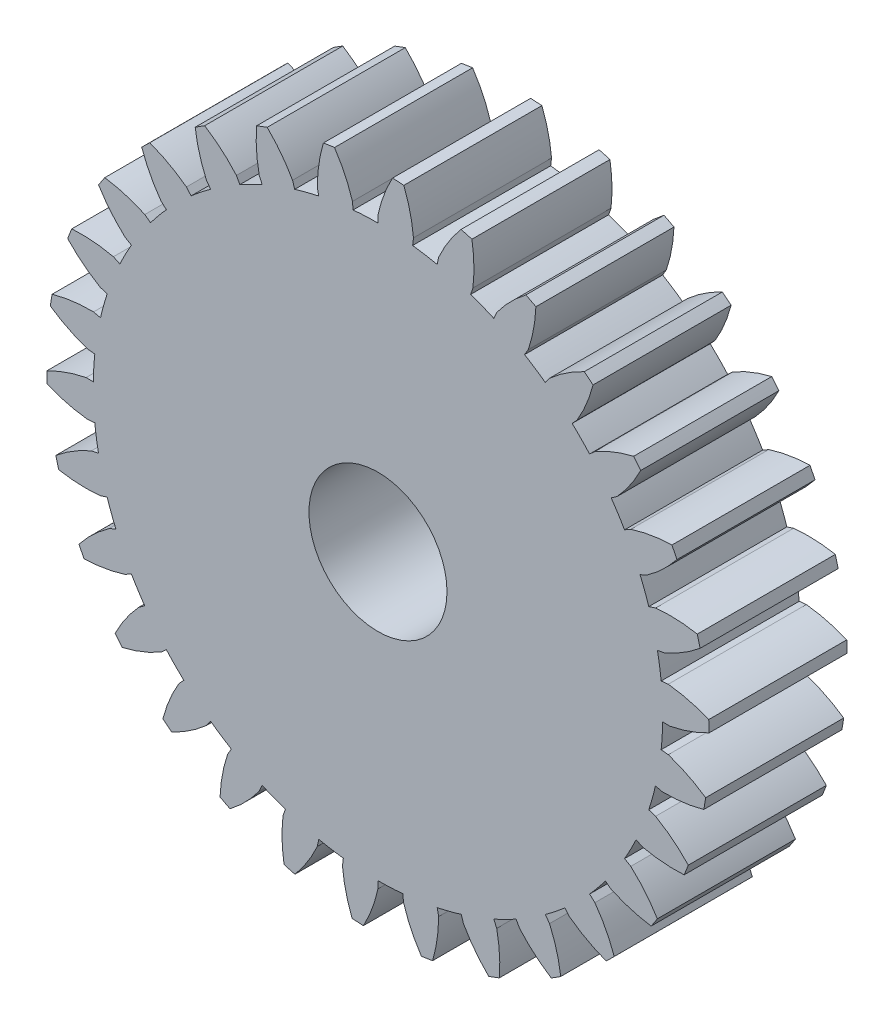
from build123d import *

# Parameters (mm, degrees)
BOSS_EXTRUDE1_DEPTH = 4
CIRPATTERN1_COUNT   = 30
SKETCH6_R           = 8.25
SKETCH6_R_2         = 2
BOSS_EXTRUDE3_DEPTH = 4


with BuildPart() as part:
    # Sketch3 → Boss-Extrude1 (new body)
    with BuildSketch(Plane.XY):
        with BuildLine():
            Line((1.028784776, 8.394426832), (1.003575733, 8.188732243))
            ThreePointArc((1.003575733, 8.188732243), (0.502722088, 8.234668816), (0, 8.25))
            Line((0, 8.25), (0, 8.457233587))
            ThreePointArc((0, 8.457233587), (0.169904801, 9.039239134), (0.42181256, 9.590728552))
            ThreePointArc((0.42181256, 9.590728552), (0.584985702, 9.582160076), (0.747989373, 9.570815634))
            ThreePointArc((0.747989373, 9.570815634), (0.930940136, 8.992778337), (1.028784776, 8.394426832))
        make_face()
    extrude(amount=BOSS_EXTRUDE1_DEPTH)


with BuildPart() as cirpattern1_1:
    # CirPattern1: pattern copy
    add(part.part.rotate(Axis((0, 0, 0), (0, 0, 1)), 1 * 360 / CIRPATTERN1_COUNT))


with BuildPart() as cirpattern1_2:
    # CirPattern1: pattern copy
    add(part.part.rotate(Axis((0, 0, 0), (0, 0, 1)), 2 * 360 / CIRPATTERN1_COUNT))


with BuildPart() as cirpattern1_3:
    # CirPattern1: pattern copy
    add(part.part.rotate(Axis((0, 0, 0), (0, 0, 1)), 3 * 360 / CIRPATTERN1_COUNT))


with BuildPart() as cirpattern1_4:
    # CirPattern1: pattern copy
    add(part.part.rotate(Axis((0, 0, 0), (0, 0, 1)), 4 * 360 / CIRPATTERN1_COUNT))


with BuildPart() as cirpattern1_5:
    # CirPattern1: pattern copy
    add(part.part.rotate(Axis((0, 0, 0), (0, 0, 1)), 5 * 360 / CIRPATTERN1_COUNT))


with BuildPart() as cirpattern1_6:
    # CirPattern1: pattern copy
    add(part.part.rotate(Axis((0, 0, 0), (0, 0, 1)), 6 * 360 / CIRPATTERN1_COUNT))


with BuildPart() as cirpattern1_7:
    # CirPattern1: pattern copy
    add(part.part.rotate(Axis((0, 0, 0), (0, 0, 1)), 7 * 360 / CIRPATTERN1_COUNT))


with BuildPart() as cirpattern1_8:
    # CirPattern1: pattern copy
    add(part.part.rotate(Axis((0, 0, 0), (0, 0, 1)), 8 * 360 / CIRPATTERN1_COUNT))


with BuildPart() as cirpattern1_9:
    # CirPattern1: pattern copy
    add(part.part.rotate(Axis((0, 0, 0), (0, 0, 1)), 9 * 360 / CIRPATTERN1_COUNT))


with BuildPart() as cirpattern1_10:
    # CirPattern1: pattern copy
    add(part.part.rotate(Axis((0, 0, 0), (0, 0, 1)), 10 * 360 / CIRPATTERN1_COUNT))


with BuildPart() as cirpattern1_11:
    # CirPattern1: pattern copy
    add(part.part.rotate(Axis((0, 0, 0), (0, 0, 1)), 11 * 360 / CIRPATTERN1_COUNT))


with BuildPart() as cirpattern1_12:
    # CirPattern1: pattern copy
    add(part.part.rotate(Axis((0, 0, 0), (0, 0, 1)), 12 * 360 / CIRPATTERN1_COUNT))


with BuildPart() as cirpattern1_13:
    # CirPattern1: pattern copy
    add(part.part.rotate(Axis((0, 0, 0), (0, 0, 1)), 13 * 360 / CIRPATTERN1_COUNT))


with BuildPart() as cirpattern1_14:
    # CirPattern1: pattern copy
    add(part.part.rotate(Axis((0, 0, 0), (0, 0, 1)), 14 * 360 / CIRPATTERN1_COUNT))


with BuildPart() as cirpattern1_15:
    # CirPattern1: pattern copy
    add(part.part.rotate(Axis((0, 0, 0), (0, 0, 1)), 15 * 360 / CIRPATTERN1_COUNT))


with BuildPart() as cirpattern1_16:
    # CirPattern1: pattern copy
    add(part.part.rotate(Axis((0, 0, 0), (0, 0, 1)), 16 * 360 / CIRPATTERN1_COUNT))


with BuildPart() as cirpattern1_17:
    # CirPattern1: pattern copy
    add(part.part.rotate(Axis((0, 0, 0), (0, 0, 1)), 17 * 360 / CIRPATTERN1_COUNT))


with BuildPart() as cirpattern1_18:
    # CirPattern1: pattern copy
    add(part.part.rotate(Axis((0, 0, 0), (0, 0, 1)), 18 * 360 / CIRPATTERN1_COUNT))


with BuildPart() as cirpattern1_19:
    # CirPattern1: pattern copy
    add(part.part.rotate(Axis((0, 0, 0), (0, 0, 1)), 19 * 360 / CIRPATTERN1_COUNT))


with BuildPart() as cirpattern1_20:
    # CirPattern1: pattern copy
    add(part.part.rotate(Axis((0, 0, 0), (0, 0, 1)), 20 * 360 / CIRPATTERN1_COUNT))


with BuildPart() as cirpattern1_21:
    # CirPattern1: pattern copy
    add(part.part.rotate(Axis((0, 0, 0), (0, 0, 1)), 21 * 360 / CIRPATTERN1_COUNT))


with BuildPart() as cirpattern1_22:
    # CirPattern1: pattern copy
    add(part.part.rotate(Axis((0, 0, 0), (0, 0, 1)), 22 * 360 / CIRPATTERN1_COUNT))


with BuildPart() as cirpattern1_23:
    # CirPattern1: pattern copy
    add(part.part.rotate(Axis((0, 0, 0), (0, 0, 1)), 23 * 360 / CIRPATTERN1_COUNT))


with BuildPart() as cirpattern1_24:
    # CirPattern1: pattern copy
    add(part.part.rotate(Axis((0, 0, 0), (0, 0, 1)), 24 * 360 / CIRPATTERN1_COUNT))


with BuildPart() as cirpattern1_25:
    # CirPattern1: pattern copy
    add(part.part.rotate(Axis((0, 0, 0), (0, 0, 1)), 25 * 360 / CIRPATTERN1_COUNT))


with BuildPart() as cirpattern1_26:
    # CirPattern1: pattern copy
    add(part.part.rotate(Axis((0, 0, 0), (0, 0, 1)), 26 * 360 / CIRPATTERN1_COUNT))


with BuildPart() as cirpattern1_27:
    # CirPattern1: pattern copy
    add(part.part.rotate(Axis((0, 0, 0), (0, 0, 1)), 27 * 360 / CIRPATTERN1_COUNT))


with BuildPart() as cirpattern1_28:
    # CirPattern1: pattern copy
    add(part.part.rotate(Axis((0, 0, 0), (0, 0, 1)), 28 * 360 / CIRPATTERN1_COUNT))


with BuildPart() as cirpattern1_29:
    # CirPattern1: pattern copy
    add(part.part.rotate(Axis((0, 0, 0), (0, 0, 1)), 29 * 360 / CIRPATTERN1_COUNT))


with BuildPart() as part_1:
    add(part.part)

    add(cirpattern1_1.part)  # Boss-Extrude3 merges CirPattern1_1

    add(cirpattern1_2.part)  # Boss-Extrude3 merges CirPattern1_2

    add(cirpattern1_3.part)  # Boss-Extrude3 merges CirPattern1_3

    add(cirpattern1_4.part)  # Boss-Extrude3 merges CirPattern1_4

    add(cirpattern1_5.part)  # Boss-Extrude3 merges CirPattern1_5

    add(cirpattern1_6.part)  # Boss-Extrude3 merges CirPattern1_6

    add(cirpattern1_7.part)  # Boss-Extrude3 merges CirPattern1_7

    add(cirpattern1_8.part)  # Boss-Extrude3 merges CirPattern1_8

    add(cirpattern1_9.part)  # Boss-Extrude3 merges CirPattern1_9

    add(cirpattern1_10.part)  # Boss-Extrude3 merges CirPattern1_10

    add(cirpattern1_11.part)  # Boss-Extrude3 merges CirPattern1_11

    add(cirpattern1_12.part)  # Boss-Extrude3 merges CirPattern1_12

    add(cirpattern1_13.part)  # Boss-Extrude3 merges CirPattern1_13

    add(cirpattern1_14.part)  # Boss-Extrude3 merges CirPattern1_14

    add(cirpattern1_15.part)  # Boss-Extrude3 merges CirPattern1_15

    add(cirpattern1_16.part)  # Boss-Extrude3 merges CirPattern1_16

    add(cirpattern1_17.part)  # Boss-Extrude3 merges CirPattern1_17

    add(cirpattern1_18.part)  # Boss-Extrude3 merges CirPattern1_18

    add(cirpattern1_19.part)  # Boss-Extrude3 merges CirPattern1_19

    add(cirpattern1_20.part)  # Boss-Extrude3 merges CirPattern1_20

    add(cirpattern1_21.part)  # Boss-Extrude3 merges CirPattern1_21

    add(cirpattern1_22.part)  # Boss-Extrude3 merges CirPattern1_22

    add(cirpattern1_23.part)  # Boss-Extrude3 merges CirPattern1_23

    add(cirpattern1_24.part)  # Boss-Extrude3 merges CirPattern1_24

    add(cirpattern1_25.part)  # Boss-Extrude3 merges CirPattern1_25

    add(cirpattern1_26.part)  # Boss-Extrude3 merges CirPattern1_26

    add(cirpattern1_27.part)  # Boss-Extrude3 merges CirPattern1_27

    add(cirpattern1_28.part)  # Boss-Extrude3 merges CirPattern1_28

    add(cirpattern1_29.part)  # Boss-Extrude3 merges CirPattern1_29
    # Sketch6 → Boss-Extrude3 (add)
    with BuildSketch(Plane.XY):
        Circle(SKETCH6_R)
        Circle(SKETCH6_R_2, mode=Mode.SUBTRACT)
    extrude(amount=BOSS_EXTRUDE3_DEPTH)


solid = part_1.part
